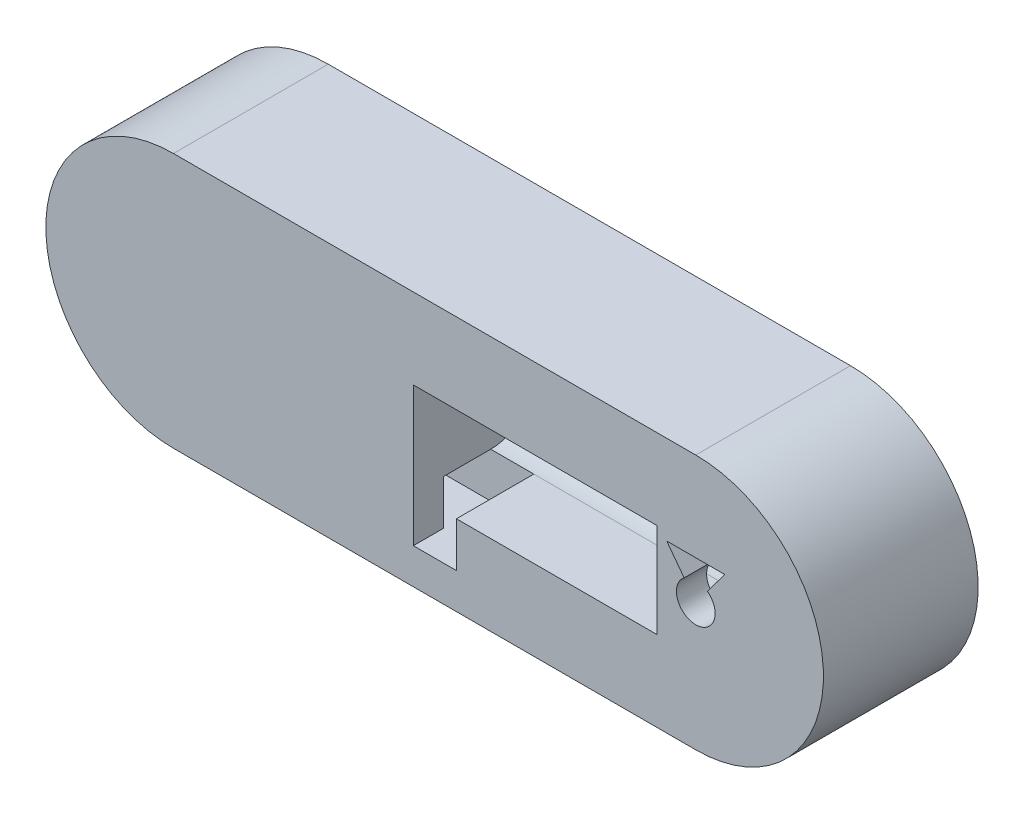
from build123d import *

# Parameters (mm, degrees)
SALIENTE_EXTRUIR1_DEPTH = 40
CORTAR_EXTRUIR2_DEPTH   = 10
CORTAR_EXTRUIR4_DEPTH   = 20
CROQUIS6_R              = 12.2
CORTAR_EXTRUIR6_DEPTH   = 63
CROQUIS7_W              = 24.4
CROQUIS7_H              = 24.4
CORTAR_EXTRUIR9_DEPTH   = 30
CROQUIS8_W              = 12.2
CROQUIS8_H              = 11.6
CORTAR_EXTRUIR10_DEPTH  = 50
CORTAR_EXTRUIR11_REACH  = 123.586
CROQUIS9_W              = 11.6
CROQUIS9_H              = 11.6
CHAFL_N1_SIZE           = 10


with BuildPart() as part:
    # Croquis1 → Saliente-Extruir1 (new body)
    with BuildSketch(Plane.XY):
        with BuildLine():
            Line((76.972889038, 33), (-58.027110962, 33))
            ThreePointArc((-58.027110962, 33), (-91.027110962, 0), (-58.027110962, -33))
            Line((-58.027110962, -33), (76.972889038, -33))
            ThreePointArc((76.972889038, -33), (109.972889038, 0), (76.972889038, 33))
        make_face()
        with BuildLine():
            Line((69.472889038, 10), (84.472889038, 10))
            Line((84.472889038, 10), (79.972889038, 4))
            ThreePointArc((79.972889038, 4), (76.972889038, -5), (73.972889038, 4))
            Line((73.972889038, 4), (69.472889038, 10))
        make_face(mode=Mode.SUBTRACT)
    extrude(amount=SALIENTE_EXTRUIR1_DEPTH)

    # Croquis1<4> → Cortar-Extruir2 (cut)
    with BuildSketch(Plane.XY):
        with BuildLine():
            Line((-54.234058455, -3.257722008), (-54.234058455, 3.257722008))
            ThreePointArc((-54.234058455, 3.257722008), (-63.027110962, 0), (-54.234058455, -3.257722008))
        make_face()
    extrude(amount=CORTAR_EXTRUIR2_DEPTH, mode=Mode.SUBTRACT)

    # Croquis5 → Cortar-Extruir4 (cut)
    with BuildSketch(Plane.XY.offset(40)):
        Polygon((66.972889038, -12.2), (66.972889038, 12.2), (3.972889038, 12.2), (3.972889038, -23.8), (15.110447518, -23.8), (15.110447518, -12.2), align=None)
    extrude(amount=-CORTAR_EXTRUIR4_DEPTH, mode=Mode.SUBTRACT)

    # Croquis6 → Cortar-Extruir6 (cut)
    with BuildSketch(Plane(origin=(3.972889038, 0, 0), x_dir=(0, 0, -1), z_dir=(1, 0, 0))):
        with Locations((-20, 0)):
            Circle(CROQUIS6_R)
        with BuildLine():
            ThreePointArc((-20, -12.2), (-32.2, 0), (-20, 12.2))
            Line((-20, 12.2), (-40, 12.2))
            Line((-40, 12.2), (-40, -12.2))
            Line((-40, -12.2), (-20, -12.2))
        make_face()
    extrude(amount=CORTAR_EXTRUIR6_DEPTH, mode=Mode.SUBTRACT)

    # Croquis7 → Cortar-Extruir9 (cut)
    with BuildSketch(Plane.ZY.offset(-66.972889038)):
        with Locations((20, 0)):
            Rectangle(CROQUIS7_W, CROQUIS7_H)
    extrude(amount=-CORTAR_EXTRUIR9_DEPTH, mode=Mode.SUBTRACT)

    # Croquis8 → Cortar-Extruir10 (cut)
    with BuildSketch(Plane(origin=(3.972889038, 0, 0), x_dir=(0, 0, -1), z_dir=(1, 0, 0))):
        with Locations((-26.1, -18)):
            Rectangle(CROQUIS8_W, CROQUIS8_H)
    extrude(amount=-CORTAR_EXTRUIR10_DEPTH, mode=Mode.SUBTRACT)

    # Croquis9 → Cortar-Extruir11 (cut, up to next)
    with BuildSketch(Plane(origin=(0, 0, 0), x_dir=(-1, 0, 0), z_dir=(0, 0, -1)), mode=Mode.PRIVATE) as cortar_extruir11_sk1:
        with Locations((40.227110962, -18)):
            Rectangle(CROQUIS9_W, CROQUIS9_H)
    cortar_extruir11_tool1 = extrude(cortar_extruir11_sk1.sketch, amount=-CORTAR_EXTRUIR11_REACH, mode=Mode.PRIVATE) & part.part
    add(cortar_extruir11_tool1.solids().sort_by_distance((-40.227111, -18, 0))[0], mode=Mode.SUBTRACT)

    # Chaflán1
    chafl_n1_edges = [part.edges().sort_by_distance(p)[0] for p in [
        (-46.027110962, -18, 0),
    ]]
    chamfer(chafl_n1_edges, length=CHAFL_N1_SIZE)


solid = part.part
